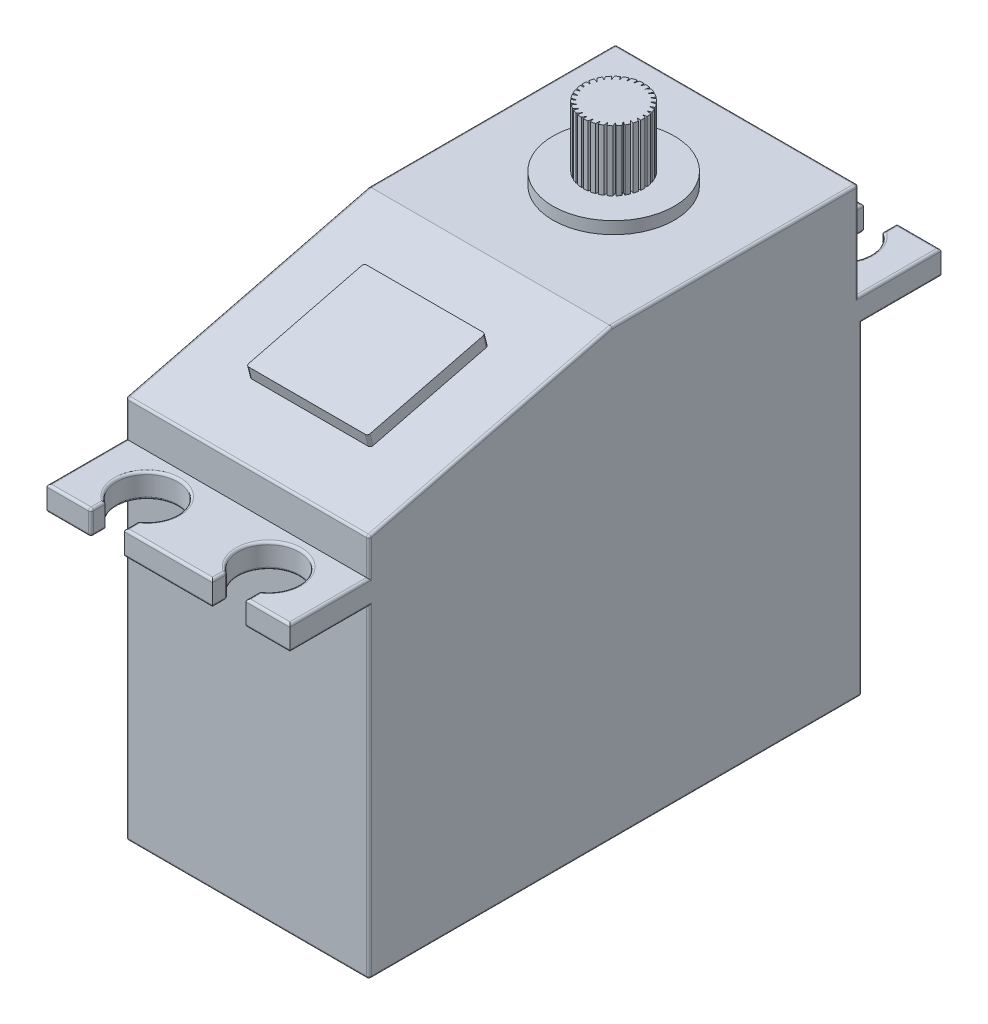
from build123d import *

# Parameters (mm, degrees)
SKETCH1_W           = 53.6
SKETCH1_H           = 36.6
BOSS_EXTRUDE1_DEPTH = 20
SKETCH2_W           = 6.5
SKETCH2_H           = 26.6
SKETCH2_H_2         = 8
SKETCH2_W_2         = 6.8
CUT_EXTRUDE1_DEPTH  = 39.119942287
CUT_EXTRUDE2_DEPTH  = 45.002272669
CUT_EXTRUDE3_DEPTH  = 39.119942287
SKETCH5_R           = 5
BOSS_EXTRUDE2_DEPTH = 1
SKETCH6_R           = 2.5
BOSS_EXTRUDE3_DEPTH = 5
CUT_EXTRUDE4_START  = -5
CUT_EXTRUDE4_DEPTH  = 5
CIRPATTERN1_COUNT   = 30
SKETCH8_W           = 10
SKETCH8_H           = 10
BOSS_EXTRUDE4_DEPTH = 1
FILLET1_R           = 0.2


with BuildPart() as part:
    # Sketch1 → Boss-Extrude1 (new body)
    with BuildSketch(Plane(origin=(0, 0, 0), x_dir=(0, 0, -1), z_dir=(1, 0, 0))):
        Rectangle(SKETCH1_W, SKETCH1_H)
    extrude(amount=BOSS_EXTRUDE1_DEPTH)

    # Sketch2 → Cut-Extrude1 (cut, through all)
    with BuildSketch(Plane(origin=(20, 0, 0), x_dir=(0, 0, -1), z_dir=(1, 0, 0))):
        with Locations((-23.55, -5)):
            Rectangle(SKETCH2_W, SKETCH2_H)
        with Locations((23.55, -5)):
            Rectangle(SKETCH2_W, SKETCH2_H)
        with Locations((-23.55, 14.3)):
            Rectangle(SKETCH2_W, SKETCH2_H_2)
        with Locations((23.4, 14.3)):
            Rectangle(SKETCH2_W_2, SKETCH2_H_2)
    extrude(amount=-CUT_EXTRUDE1_DEPTH, mode=Mode.SUBTRACT)

    # Sketch3 → Cut-Extrude2 (cut, through all)
    with BuildSketch(Plane(origin=(0, 10.3, 0), x_dir=(1, 0, 0), z_dir=(0, 1, 0))):
        with BuildLine():
            Line((3.624018662, -26.8), (6.375981338, -26.8))
            Line((6.375981338, -26.8), (6.375981338, -25.637265043))
            ThreePointArc((6.375981338, -25.637265043), (5, -21.05), (3.624018662, -25.637265043))
            Line((3.624018662, -25.637265043), (3.624018662, -26.8))
        make_face()
        with BuildLine():
            Line((16.375981338, -26.8), (16.375981338, -25.637265043))
            ThreePointArc((16.375981338, -25.637265043), (15, -21.05), (13.624018662, -25.637265043))
            Line((13.624018662, -25.637265043), (13.624018662, -26.8))
            Line((13.624018662, -26.8), (16.375981338, -26.8))
        make_face()
    cut_extrude2 = extrude(amount=-CUT_EXTRUDE2_DEPTH, mode=Mode.SUBTRACT)

    # Mirror1: Cut-Extrude2 across plane
    add(cut_extrude2.mirror(Plane.XY), mode=Mode.SUBTRACT)

    # Sketch4 → Cut-Extrude3 (cut, through all)
    with BuildSketch(Plane(origin=(20, 0, 0), x_dir=(0, 0, -1), z_dir=(1, 0, 0))):
        Polygon((-20.3, 18.3), (-0.3, 18.3), (-20.3, 13.3), align=None)
    extrude(amount=-CUT_EXTRUDE3_DEPTH, mode=Mode.SUBTRACT)

    # Sketch5 → Boss-Extrude2 (add)
    with BuildSketch(Plane(origin=(0, 18.3, 0), x_dir=(1, 0, 0), z_dir=(0, 1, 0))):
        with Locations(Location((10, 9.85, 0), (0, 0, 270))):
            Circle(SKETCH5_R)
    extrude(amount=BOSS_EXTRUDE2_DEPTH)

    # Sketch6 → Boss-Extrude3 (add)
    with BuildSketch(Plane(origin=(0, 19.3, 0), x_dir=(1, 0, 0), z_dir=(0, 1, 0))):
        with Locations(Location((10, 9.85, 0), (0, 0, 270))):
            Circle(SKETCH6_R)
    extrude(amount=BOSS_EXTRUDE3_DEPTH)

    # Sketch7 → Cut-Extrude4 (cut)
    with BuildSketch(Plane(origin=(0, 24.3, 0), x_dir=(1, 0, 0), z_dir=(0, 1, 0)).offset(CUT_EXTRUDE4_START)):
        with BuildLine():
            Line((10, 12.35), (10, 12.014395148))
            Line((10, 12.014395148), (10.168595588, 12.344308627))
            ThreePointArc((10.168595588, 12.344308627), (10.084345812, 12.348576752), (10, 12.35))
        make_face()
    cut_extrude4 = extrude(amount=CUT_EXTRUDE4_DEPTH, mode=Mode.SUBTRACT)

    # CirPattern1: Cut-Extrude4 ×30 about axis
    cirpattern1_axis = Axis((10, 0, -9.85), (0, 1, 0))
    for i in range(1, CIRPATTERN1_COUNT):
        add(cut_extrude4.rotate(cirpattern1_axis, i * 360 / CIRPATTERN1_COUNT), mode=Mode.SUBTRACT)

    # Sketch8 → Boss-Extrude4 (add)
    with BuildSketch(Plane(origin=(0, 17.294117647, 4.323529412), x_dir=(1, 0, 0), z_dir=(0, 0.9701425001453319, 0.24253562503633305))):
        with Locations((10, -6.160404876)):
            Rectangle(SKETCH8_W, SKETCH8_H)
    extrude(amount=BOSS_EXTRUDE4_DEPTH)

    # Fillet1
    fillet1_edges = [part.edges().sort_by_distance(p)[0] for p in [
        (10, 8.3, -26.8),
        (18.187990669, 8.3, -26.8),
        (5, 8.3, -21.05),
        (6.375981338, 8.3, -26.218632521),
        (3.624018662, 8.3, -26.218632521),
        (16.375981338, 8.3, -26.218632521),
        (15, 8.3, -21.05),
        (13.624018662, 8.3, -26.218632521),
        (10, 10.3, -26.8),
        (18.187990669, 10.3, -26.8),
        (15, 10.3, -21.05),
        (13.624018662, 10.3, -26.218632521),
        (16.375981338, 10.3, -26.218632521),
        (3.624018662, 10.3, -26.218632521),
        (6.375981338, 10.3, -26.218632521),
        (5, 10.3, -21.05),
        (0, -18.3, 0),
        (10, 13.3, 20.3),
        (0, 15.8, 10.3),
        (20, 15.8, 10.3),
        (0, 18.3, -9.85),
        (20, 18.3, -9.85),
        (20, -18.3, 0),
        (1.812009331, 8.3, -26.8),
        (0, -5, -20.3),
        (10, -18.3, -20.3),
        (0, 8.3, -23.55),
        (20, 8.3, -23.55),
        (20, -5, -20.3),
        (1.812009331, 10.3, 26.8),
        (0, 11.8, 20.3),
        (0, 10.3, 23.55),
        (20, 10.3, 23.55),
        (20, 11.8, 20.3),
        (0, 10.3, -23.4),
        (1.812009331, 10.3, -26.8),
        (0, 14.3, -20),
        (10, 18.3, -20),
        (20, 14.3, -20),
        (20, 10.3, -23.4),
        (0, -5, 20.3),
        (5, 17.497749375, 5.570555312),
        (5, 15.072393125, 15.271980313),
        (10, -18.3, 20.3),
        (15, 15.072393125, 15.271980313),
        (15, 17.497749375, 5.570555312),
        (0, 8.3, 23.55),
        (1.812009331, 8.3, 26.8),
        (20, -5, 20.3),
        (20, 8.3, 23.55),
        (10, 10.3, 26.8),
        (18.187990669, 10.3, 26.8),
        (10, 8.3, 26.8),
        (18.187990669, 8.3, 26.8),
        (15, 8.3, 21.05),
        (13.624018662, 9.3, 25.637265043),
        (16.375981338, 8.3, 26.218632521),
        (16.375981338, 9.3, 25.637265043),
        (13.624018662, 8.3, 26.218632521),
        (15, 10.3, 21.05),
        (13.624018662, 10.3, 26.218632521),
        (16.375981338, 10.3, 26.218632521),
        (3.624018662, 8.3, 26.218632521),
        (3.624018662, 9.3, 26.8),
        (5, 8.3, 21.05),
        (6.375981338, 8.3, 26.218632521),
        (3.624018662, 10.3, 26.218632521),
        (6.375981338, 10.3, 26.218632521),
        (5, 10.3, 21.05),
    ]]
    fillet(fillet1_edges, radius=FILLET1_R)


solid = part.part
